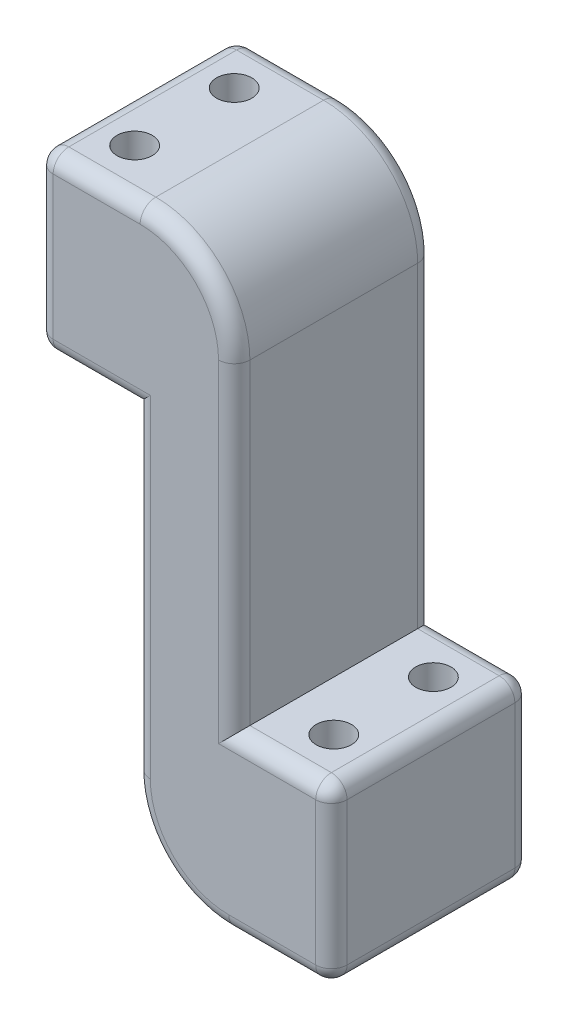
from build123d import *

# Parameters (mm, degrees)
BOSS_EXTRUDE1_DEPTH = 25.4
SKETCH2_R           = 2.25
CUT_EXTRUDE1_DEPTH  = 88.290380725
FILLET1_R           = 2


with BuildPart() as part:
    # Sketch1 → Boss-Extrude1 (new body)
    with BuildSketch(Plane.XY):
        with BuildLine():
            Line((-12.3952, 40.3748), (-12.3952, 0))
            Line((-12.3952, 0), (-12.3952, -22.2504))
            Line((-12.3952, -22.2504), (-13.0952, -22.2504))
            ThreePointArc((-13.0952, -22.2504), (-21.580481374, -18.735681374), (-25.0952, -10.2504))
            Line((-25.0952, -10.2504), (-25.0952, 30.1244))
            Line((-25.0952, 30.1244), (-25.0952, 52.3748))
            Line((-25.0952, 52.3748), (-24.3952, 52.3748))
            ThreePointArc((-24.3952, 52.3748), (-15.909918626, 48.860081374), (-12.3952, 40.3748))
        make_face()
        with BuildLine():
            ThreePointArc((-37.4904, 50.3748), (-36.904613562, 51.789013562), (-35.4904, 52.3748))
            Line((-35.4904, 52.3748), (-25.0952, 52.3748))
            Line((-25.0952, 52.3748), (-25.0952, 30.1244))
            Line((-25.0952, 30.1244), (-35.4904, 30.1244))
            ThreePointArc((-35.4904, 30.1244), (-36.904613562, 30.710186438), (-37.4904, 32.1244))
            Line((-37.4904, 32.1244), (-37.4904, 50.3748))
        make_face()
        with BuildLine():
            ThreePointArc((0, -20.2504), (-0.585786438, -21.664613562), (-2, -22.2504))
            Line((-2, -22.2504), (-12.3952, -22.2504))
            Line((-12.3952, -22.2504), (-12.3952, 0))
            Line((-12.3952, 0), (-2, 0))
            ThreePointArc((-2, 0), (-0.585786438, -0.585786438), (0, -2))
            Line((0, -2), (0, -20.2504))
        make_face()
    extrude(amount=BOSS_EXTRUDE1_DEPTH)

    # Sketch2 → Cut-Extrude1 (cut, through all)
    with BuildSketch(Plane(origin=(0, 52.3748, 0), x_dir=(1, 0, 0), z_dir=(0, 1, 0))):
        with Locations(Location((-31.4452, -6.35, 0), (0, 0, 270))):
            Circle(SKETCH2_R)
        with Locations(Location((-31.4452, -19.05, 0), (0, 0, 270))):
            Circle(SKETCH2_R)
        with Locations(Location((-6.0452, -6.35, 0), (0, 0, 270))):
            Circle(SKETCH2_R)
        with Locations(Location((-6.0452, -19.05, 0), (0, 0, 270))):
            Circle(SKETCH2_R)
    extrude(amount=-CUT_EXTRUDE1_DEPTH, mode=Mode.SUBTRACT)

    # Fillet1
    fillet1_edges = [part.edges().sort_by_distance(p)[0] for p in [
        (-15.909918626, 48.860081374, 25.4),
        (-29.9428, 52.3748, 25.4),
        (-7.1976, 0, 0),
        (-0.585786438, -0.585786438, 0),
        (0, -11.1252, 0),
        (-0.585786438, -21.664613562, 0),
        (-7.5476, -22.2504, 0),
        (-21.580481374, -18.735681374, 0),
        (-25.0952, 9.937, 0),
        (-30.2928, 30.1244, 0),
        (-36.904613562, 30.710186438, 0),
        (-37.4904, 41.2496, 0),
        (-36.904613562, 51.789013562, 0),
        (-29.9428, 52.3748, 0),
        (-15.909918626, 48.860081374, 0),
        (-36.904613562, 51.789013562, 25.4),
        (-12.3952, 20.1874, 0),
        (-37.4904, 41.2496, 25.4),
        (-36.904613562, 30.710186438, 25.4),
        (-30.2928, 30.1244, 25.4),
        (-25.0952, 9.937, 25.4),
        (-21.580481374, -18.735681374, 25.4),
        (-12.3952, 20.1874, 25.4),
        (-7.5476, -22.2504, 25.4),
        (-0.585786438, -21.664613562, 25.4),
        (0, -11.1252, 25.4),
        (-0.585786438, -0.585786438, 25.4),
        (-7.1976, 0, 25.4),
    ]]
    fillet(fillet1_edges, radius=FILLET1_R)


solid = part.part
